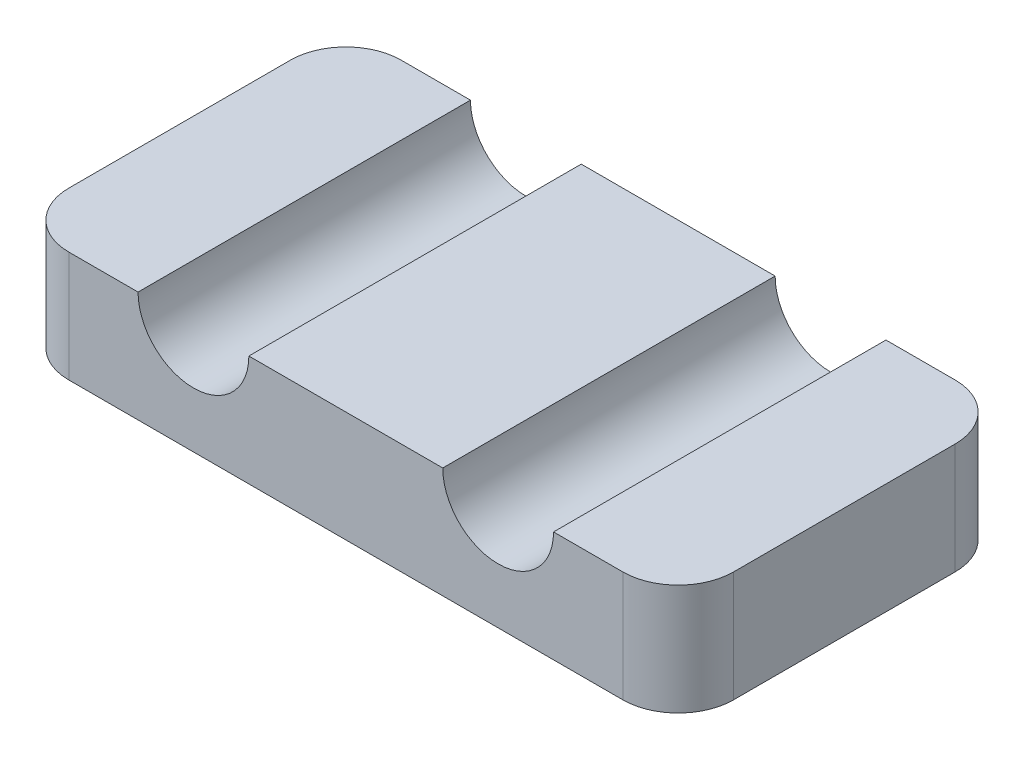
from build123d import *

# Parameters (mm, degrees)
BOSS_EXTRUDE1_DEPTH = 76.2
FILLET1_R           = 25.4


with BuildPart() as part:
    # Sketch1 → Boss-Extrude1 (new, symmetric)
    with BuildSketch(Plane.XY):
        with BuildLine():
            Line((-152.4, 25.4), (-152.4, -25.4))
            Line((-152.4, -25.4), (152.4, -25.4))
            Line((152.4, -25.4), (152.4, 25.4))
            Line((152.4, 25.4), (95.25, 25.4))
            ThreePointArc((95.25, 25.4), (69.85, 0), (44.45, 25.4))
            Line((44.45, 25.4), (-44.45, 25.4))
            ThreePointArc((-44.45, 25.4), (-69.85, 0), (-95.25, 25.4))
            Line((-95.25, 25.4), (-152.4, 25.4))
        make_face()
    extrude(amount=BOSS_EXTRUDE1_DEPTH, both=True)

    # Fillet1
    fillet1_edges = [part.edges().sort_by_distance(p)[0] for p in [
        (-152.4, 0, -76.2),
        (-152.4, 0, 76.2),
        (152.4, 0, 76.2),
        (152.4, 0, -76.2),
    ]]
    fillet(fillet1_edges, radius=FILLET1_R)


solid = part.part
